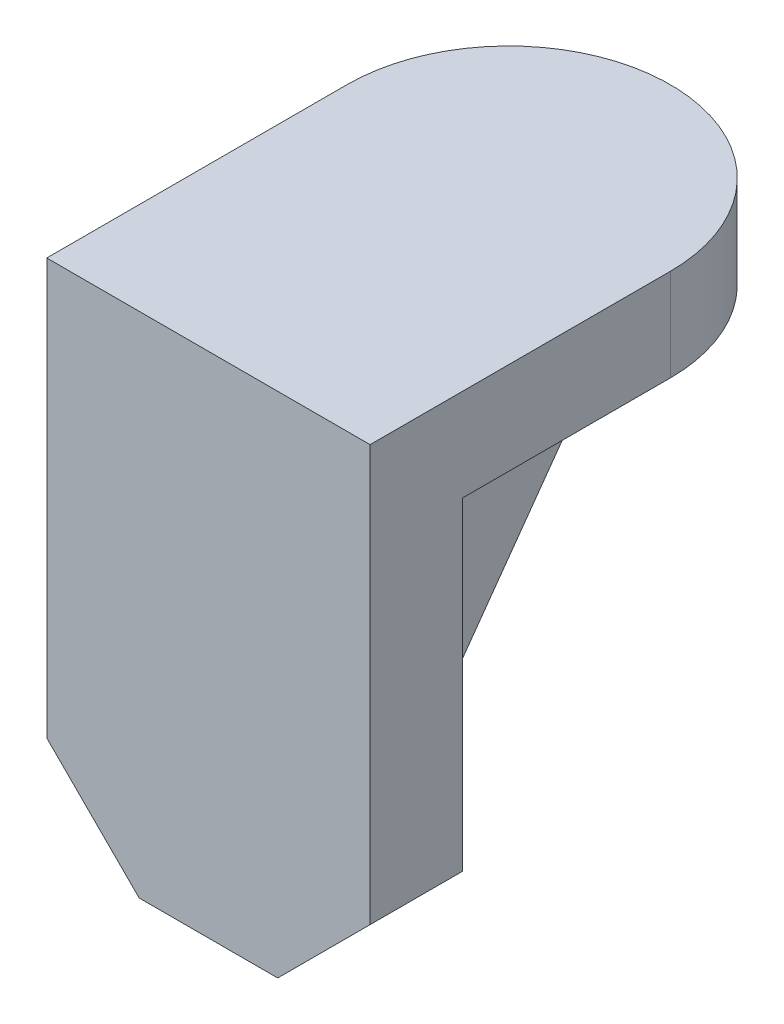
from build123d import *

# Parameters (mm, degrees)
BOSS_EXTRUDE2_DEPTH = 12
BOSS_EXTRUDE4_DEPTH = 12
RIB1_REACH          = 81.189
SKETCH7_WALLS_W     = 12
SKETCH7_WALLS_H     = 226.916782225


with BuildPart() as part:
    # Sketch1 → Boss-Extrude2 (new body)
    with BuildSketch(Plane.XY):
        Polygon((-31.541899517, 54.96059397), (-31.541899517, 0.96059397), (-19.541899517, -11.03940603), (-1.541899517, -11.03940603), (10.458100483, 0.96059397), (10.458100483, 54.96059397), align=None)
    extrude(amount=BOSS_EXTRUDE2_DEPTH)

    # Sketch2 → Boss-Extrude4 (add)
    with BuildSketch(Plane(origin=(0, 54.96059397, 0), x_dir=(1, 0, 0), z_dir=(0, 1, 0))):
        with BuildLine():
            Line((10.458100483, 0), (10.458100483, 27))
            ThreePointArc((10.458100483, 27), (-10.541899517, 48), (-31.541899517, 27))
            Line((-31.541899517, 27), (-31.541899517, 0))
            Line((-31.541899517, 0), (10.458100483, 0))
        make_face()
    extrude(amount=-BOSS_EXTRUDE4_DEPTH)

    # Sketch7 walls → Rib1 (add, up to next)
    with BuildSketch(Plane(origin=(0, -3.746614572, -5.227167373), x_dir=(1, 0, 0), z_dir=(0, 0.5825680402279159, 0.8127819378560314)), mode=Mode.PRIVATE) as rib1_sk1:
        with Locations((-10.541899517, 24.296475579)):
            Rectangle(SKETCH7_WALLS_W, SKETCH7_WALLS_H)
    rib1_tool1 = extrude(rib1_sk1.sketch, amount=RIB1_REACH, mode=Mode.PRIVATE) - part.part
    add(rib1_tool1.solids().sort_by_distance((-10.541899517, 16.001121931, -19.381517535))[0])


solid = part.part
